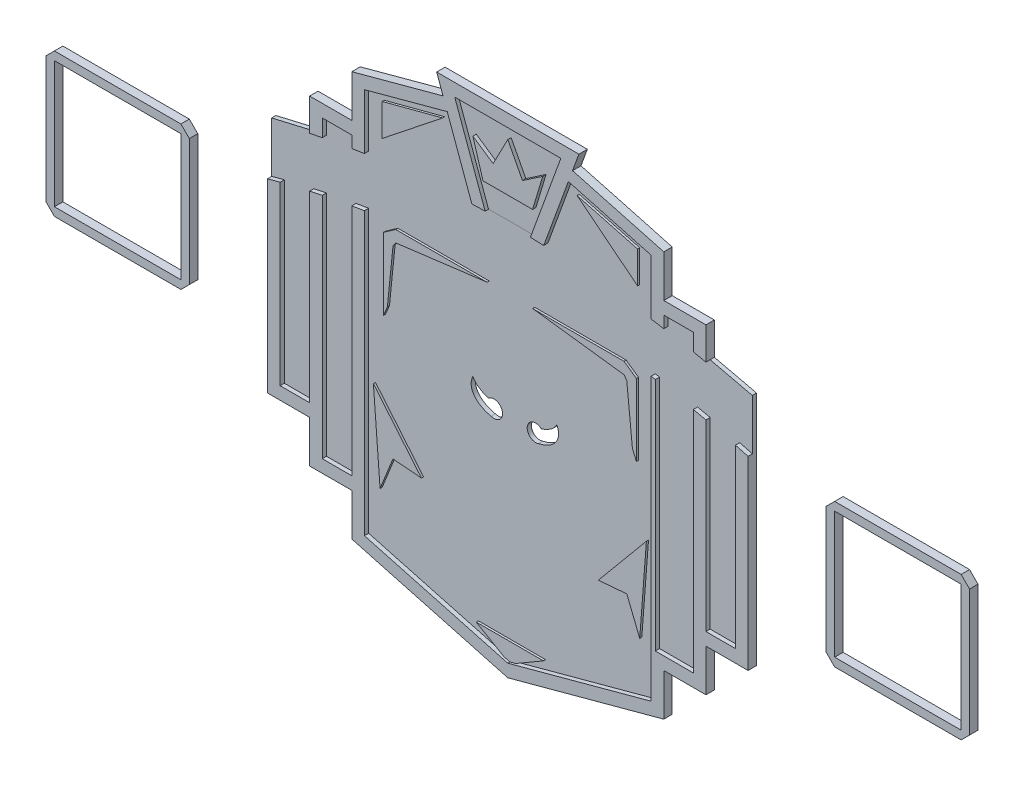
from build123d import *

# Parameters (mm, degrees)
SALIENTE_EXTRUIR1_DEPTH    = 0.5
CROQUIS3_W                 = 37
CROQUIS3_H                 = 28
CROQUIS3_H_2               = 5
CROQUIS3_W_2               = 5
SALIENTE_EXTRUIR2_DEPTH    = 0.5
SALIENTE_EXTRUIR3_DEPTH    = 0.5
SALIENTE_EXTRUIR4_DEPTH    = 0.5
SALIENTE_EXTRUIR5_DEPTH    = 0.5
CORTAR_EXTRUIR2_DEPTH      = 0.4
SALIENTE_EXTRUIR6_DEPTH    = 0.25
SALIENTE_EXTRUIR7_DEPTH    = 0.5
CROQUIS10_W                = 15
CROQUIS10_H                = 15
SALIENTE_EXTRUIR8_DEPTH    = 1
CORTAR_EXTRUIR3_DEPTH      = 62.970508338
CORTAR_EXTRUIR3_DEPTH_BACK = 62.970508338


with BuildPart() as part:
    # Croquis1 → Saliente-Extruir1 (new body)
    with BuildSketch(Plane.XY):
        Polygon((-18.5, 24), (-18.5, -24), (0, -29), (18.5, -24), (18.5, 24), (0, 29), align=None)
    extrude(amount=SALIENTE_EXTRUIR1_DEPTH)

    # Croquis3 → Saliente-Extruir2 (add)
    with BuildSketch(Plane(origin=(0, 0, 0), x_dir=(-1, 0, 0), z_dir=(0, 0, -1))):
        Rectangle(CROQUIS3_W, CROQUIS3_H)
        with Locations((0, 16.5)):
            Rectangle(CROQUIS3_W, CROQUIS3_H_2)
        with Locations((21, 16.5)):
            Rectangle(CROQUIS3_W_2, CROQUIS3_H_2)
        with Locations((-21, 16.5)):
            Rectangle(CROQUIS3_W_2, CROQUIS3_H_2)
        with Locations((-21, 0)):
            Rectangle(CROQUIS3_W_2, CROQUIS3_H)
        with Locations((-21, -16.5)):
            Rectangle(CROQUIS3_W_2, CROQUIS3_H_2)
        with Locations((-26, 0)):
            Rectangle(CROQUIS3_W_2, CROQUIS3_H)
        with Locations((0, -16.5)):
            Rectangle(CROQUIS3_W, CROQUIS3_H_2)
        with Locations((21, -16.5)):
            Rectangle(CROQUIS3_W_2, CROQUIS3_H_2)
        with Locations((26, 0)):
            Rectangle(CROQUIS3_W_2, CROQUIS3_H)
        with Locations((21, 0)):
            Rectangle(CROQUIS3_W_2, CROQUIS3_H)
    extrude(amount=-SALIENTE_EXTRUIR2_DEPTH)

    # Croquis4 → Saliente-Extruir3 (add)
    with BuildSketch(Plane.XY.offset(0.5)):
        with BuildLine():
            Line((-23.5, -12.5), (-27, -12.5))
            Line((-27, -12.5), (-27, 8.397038398))
            ThreePointArc((-27, 8.397038398), (-27.750710079, 8.201201856), (-28.5, 8))
            Line((-28.5, 8), (-28.5, -14))
            Line((-28.5, -14), (-23.5, -14))
            Line((-23.5, -14), (-23.5, -19))
            Line((-23.5, -19), (-18.5, -19))
            Line((-18.5, -19), (-18.5, -24))
            Line((-18.5, -24), (0, -29))
            Line((0, -29), (18.5, -24))
            Line((18.5, -24), (18.5, -19))
            Line((18.5, -19), (23.5, -19))
            Line((23.5, -19), (23.5, -14))
            Line((23.5, -14), (28.5, -14))
            Line((28.5, -14), (28.5, 8))
            ThreePointArc((28.5, 8), (27.750710079, 8.201201856), (27, 8.397038398))
            Line((27, 8.397038398), (27, -12.5))
            Line((27, -12.5), (23.5, -12.5))
            Line((23.5, -12.5), (23.5, 9.235063579))
            ThreePointArc((23.5, 9.235063579), (22.750569063, 9.398627996), (22, 9.556887687))
            Line((22, 9.556887687), (22, -12.5))
            Line((22, -12.5), (22, -17.5))
            Line((22, -17.5), (17.5, -17.5))
            Line((17.5, -17.5), (17.5, 10.390503169))
            ThreePointArc((17.5, 10.390503169), (17.250047021, 10.431072049), (17, 10.471057204))
            Line((17, 10.471057204), (17, -17.5))
            Line((17, -17.5), (17, -22.905405405))
            Line((17, -22.905405405), (0, -27.5))
            Line((0, -27.5), (-17, -22.905405405))
            Line((-17, -22.905405405), (-17, -17.5))
            Line((-17, -17.5), (-17, 10.471057204))
            ThreePointArc((-17, 10.471057204), (-17.750436139, 10.3492548), (-18.5, 10.222194805))
            Line((-18.5, 10.222194805), (-18.5, -17.5))
            Line((-18.5, -17.5), (-22, -17.5))
            Line((-22, -17.5), (-22, -12.5))
            Line((-22, -12.5), (-22, 9.556887687))
            ThreePointArc((-22, 9.556887687), (-22.750569063, 9.398627996), (-23.5, 9.235063579))
            Line((-23.5, 9.235063579), (-23.5, -12.5))
        make_face()
        with BuildLine():
            ThreePointArc((-23.5, 15.168806072), (-22.750510425, 15.323714329), (-22, 15.473598591))
            Line((-22, 15.473598591), (-22, 17.5))
            Line((-22, 17.5), (-18.5, 17.5))
            Line((-18.5, 17.5), (-18.5, 16.103996414))
            ThreePointArc((-18.5, 16.103996414), (-17.750391913, 16.224441985), (-17, 16.339903654))
            Line((-17, 16.339903654), (-17, 17.5))
            Line((-17, 17.5), (-17, 22.905405405))
            Line((-17, 22.905405405), (0, 27.5))
            Line((0, 27.5), (17, 22.905405405))
            Line((17, 22.905405405), (17, 17.5))
            Line((17, 17.5), (17, 16.339903654))
            ThreePointArc((17, 16.339903654), (17.750391913, 16.224441985), (18.5, 16.103996414))
            Line((18.5, 16.103996414), (18.5, 17.5))
            Line((18.5, 17.5), (22, 17.5))
            Line((22, 17.5), (22, 15.473598591))
            ThreePointArc((22, 15.473598591), (22.750510425, 15.323714329), (23.5, 15.168806072))
            Line((23.5, 15.168806072), (23.5, 19))
            Line((23.5, 19), (18.5, 19))
            Line((18.5, 19), (18.5, 24))
            Line((18.5, 24), (0, 29))
            Line((0, 29), (-18.5, 24))
            Line((-18.5, 24), (-18.5, 19))
            Line((-18.5, 19), (-23.5, 19))
            Line((-23.5, 19), (-23.5, 15.168806072))
        make_face()
    extrude(amount=SALIENTE_EXTRUIR3_DEPTH)

    # Croquis5 → Saliente-Extruir4 (add)
    with BuildSketch(Plane(origin=(0, 0, 0), x_dir=(-1, 0, 0), z_dir=(0, 0, -1))):
        Polygon((-28.5, 14), (-23.5, 14), (-23.5, 15.168806072), align=None)
        Polygon((23.5, 15.168806072), (23.5, 14), (28.5, 14), align=None)
    extrude(amount=-SALIENTE_EXTRUIR4_DEPTH)

    # Croquis6 → Saliente-Extruir5 (add)
    with BuildSketch(Plane.XY.offset(0.5)):
        with BuildLine():
            Line((-8.435064493, 29), (8.435064493, 29))
            Line((8.435064493, 29), (4.261141866, 17.532241833))
            ThreePointArc((4.261141866, 17.532241833), (0, 17.611731288), (-4.261141866, 17.532241833))
            Line((-4.261141866, 17.532241833), (-8.435064493, 29))
        make_face()
    extrude(amount=SALIENTE_EXTRUIR5_DEPTH)

    # Croquis7 → Cortar-Extruir2 (cut)
    with BuildSketch(Plane.XY.offset(1)):
        Polygon((-6.292842483, 27.5), (6.292842483, 27.5), (2.682344976, 17.580239628), (-2.682344976, 17.580239628), align=None)
        Polygon((-2.940428264, 20.572098279), (2.940428264, 20.572098279), (4.138438643, 24.565550974), (1.738411883, 22.939092077), (0, 26.280687709), (-1.738411883, 22.939092077), (-4.138438643, 24.565550974), align=None, mode=Mode.SUBTRACT)
    extrude(amount=-CORTAR_EXTRUIR2_DEPTH, mode=Mode.SUBTRACT)

    # Croquis8 → Saliente-Extruir6 (add)
    with BuildSketch(Plane.XY.offset(0.5)):
        Polygon((-15.148303606, 22.490237407), (-15.148303606, 18.690808485), (-7.971604532, 24.389951868), align=None)
        Polygon((-15.007383678, 9.114125701), (-15.007383678, 0.580508356), (-14.528374219, 1.705997831), (-13.860048888, 8.334506441), (-13.53786538, 8.771627546), (-2.700039002, 10.151280125), (-13.53786538, 10.151280125), align=None)
        Polygon((-16.188939051, -7.001925658), (-13.529080842, -10.19986997), (-10.487838676, -13.856351751), (-13.867547695, -13.574388666), (-15.395989085, -17.378782405), align=None)
        Polygon((-3.985200874, -25.392964805), (3.985200874, -25.392964805), (0, -27.71558305), align=None)
    saliente_extruir6 = extrude(amount=SALIENTE_EXTRUIR6_DEPTH)

    # Simetría1: Saliente-Extruir6 across plane
    add(saliente_extruir6.mirror(Plane(origin=(0, 0, 0), x_dir=(0, 0, 1), z_dir=(1, 0, 0))))

    # Croquis9 → Saliente-Extruir7 (add)
    with BuildSketch(Plane(origin=(0, 0, 0.5), x_dir=(-1, 0, 0), z_dir=(0, 0, -1))):
        Polygon((-8.435064493, 29), (-7.679617917, 26.92442759), (0, 29), (7.679617917, 26.92442759), (8.435064493, 29), align=None)
    extrude(amount=SALIENTE_EXTRUIR7_DEPTH)

    # Croquis12 → Cortar-Extruir3 (cut, two sides: drawn at the far end of the back side and taken through both)
    with BuildSketch(Plane.XY.offset(0.5).offset(-CORTAR_EXTRUIR3_DEPTH_BACK)):
        with BuildLine():
            ThreePointArc((3.472131917, -1.943461481), (1.81788437, -2.500947213), (3.159088449, -3.618308796))
            add(Edge.make_bspline(
                [(3.159088449, -3.618308796), (4.657781247, -3.314220334), (6.040742996, -2.211623875), (5.325246487, -0.609912734)],
                knots=[0, 0, 0, 0, 1, 1, 1, 1], degree=3))
            add(Edge.make_bspline(
                [(5.325246487, -0.609912734), (4.995890648, -1.064423792), (4.867478462, -1.245965028), (3.927461214, -1.801096852), (3.85523518, -1.809162839), (3.472131917, -1.943461481)],
                knots=[0, 0, 0, 0, 0.376187305, 0.476187305, 1, 1, 1, 1], degree=3))
        make_face()
        with BuildLine():
            ThreePointArc((-2.480544002, -3.618308796), (-1.139339923, -2.500947213), (-2.79358747, -1.943461481))
            add(Edge.make_bspline(
                [(-4.64670204, -0.609912734), (-4.317346201, -1.064423792), (-4.188934015, -1.245965028), (-3.248916768, -1.801096852), (-3.176690734, -1.809162839), (-2.79358747, -1.943461481)],
                knots=[0, 0, 0, 0, 0.376187305, 0.476187305, 1, 1, 1, 1], degree=3))
            add(Edge.make_bspline(
                [(-2.480544002, -3.618308796), (-3.9792368, -3.314220334), (-5.362198549, -2.211623875), (-4.64670204, -0.609912734)],
                knots=[0, 0, 0, 0, 1, 1, 1, 1], degree=3))
        make_face()
    extrude(amount=CORTAR_EXTRUIR3_DEPTH + CORTAR_EXTRUIR3_DEPTH_BACK, mode=Mode.SUBTRACT)


with BuildPart() as body_2:
    # Croquis10 → Saliente-Extruir8 (new body)
    with BuildSketch(Plane.XY):
        Polygon((-53.763983636, 8.5), (-38.763983636, 8.5), (-37.763983636, 7.5), (-37.763983636, -7.5), (-38.763983636, -8.5), (-53.763983636, -8.5), (-54.763983636, -7.5), (-54.763983636, 7.5), align=None)
        with Locations((-46.263983636, 0)):
            Rectangle(CROQUIS10_W, CROQUIS10_H, mode=Mode.SUBTRACT)
    extrude(amount=SALIENTE_EXTRUIR8_DEPTH)


with BuildPart() as body_3:
    # Simetría3: mirrored copy
    add(body_2.part.mirror(Plane(origin=(0, 0, 0), x_dir=(0, 0, 1), z_dir=(1, 0, 0))))


solid = Compound([part.part, body_2.part, body_3.part])
